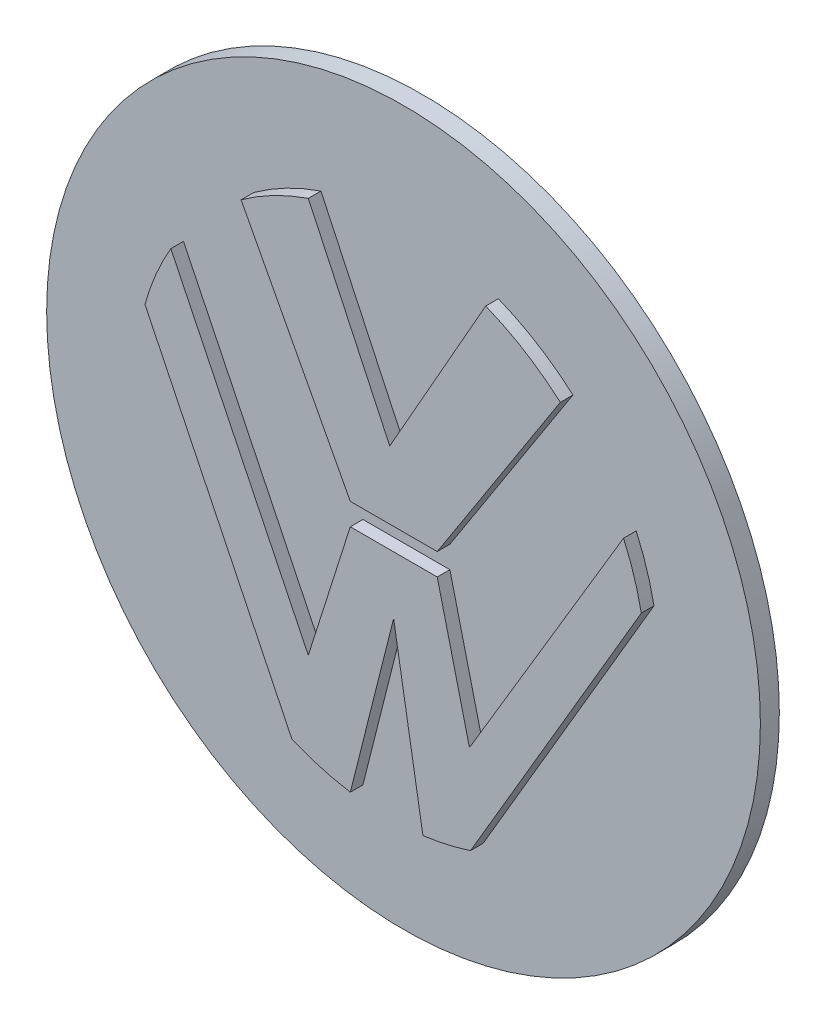
from build123d import *

# Parameters (mm, degrees)
SKETCH1_R            = 58.990480392
BOSS_EXTRUDE4_DEPTH  = 3.81
BOSS_EXTRUDE8_DEPTH  = 6.35
BOSS_EXTRUDE11_DEPTH = 6.35
BOSS_EXTRUDE12_DEPTH = 1.27
BOSS_EXTRUDE13_DEPTH = 3.81
SKETCH1_10_R         = 71.690480392
BOSS_EXTRUDE14_DEPTH = 3.81


with BuildPart() as part:
    # Sketch1 → Boss-Extrude4 (new body)
    with BuildSketch(Plane.XY):
        Circle(SKETCH1_R)
        with BuildLine():
            ThreePointArc((-44.203304283, 25.942359996), (-37.95196843, 34.446861163), (-30.091128704, 41.490506444))
            ThreePointArc((-30.091128704, 41.490506444), (-23.601953109, 45.495999397), (-16.590293497, 48.494332797))
            ThreePointArc((-16.590293497, 48.494332797), (1.313009125, 51.236843763), (19.052344379, 47.580944982))
            ThreePointArc((19.052344379, 47.580944982), (26.945123943, 43.599294116), (34.03630553, 38.320595736))
            ThreePointArc((34.03630553, 38.320595736), (41.302460875, 30.348721182), (46.739319117, 21.032693603))
            ThreePointArc((46.739319117, 21.032693603), (48.850499882, 15.510216406), (50.311661027, 9.781355549))
            ThreePointArc((50.311661027, 9.781355549), (51.017620288, 4.913305593), (51.253664764, 0))
            ThreePointArc((51.253664764, 0), (41.512829585, -30.060324875), (15.99284446, -48.694630893))
            ThreePointArc((15.99284446, -48.694630893), (11.267949041, -49.99971476), (6.439988792, -50.847464992))
            ThreePointArc((6.439988792, -50.847464992), (-0.864374418, -51.246375565), (-8.151129624, -50.601356084))
            ThreePointArc((-8.151129624, -50.601356084), (-14.115327494, -49.271651905), (-19.878887571, -47.24159164))
            ThreePointArc((-19.878887571, -47.24159164), (-46.117469302, -22.363299776), (-49.403992946, 13.644912337))
            ThreePointArc((-49.403992946, 13.644912337), (-47.205808206, 19.963712664), (-44.203304283, 25.942359996))
        make_face(mode=Mode.SUBTRACT)
    extrude(amount=BOSS_EXTRUDE4_DEPTH)

    # Sketch1<5> → Boss-Extrude8 (add)
    with BuildSketch(Plane.XY):
        with BuildLine():
            ThreePointArc((-16.590293497, 48.494332797), (-23.601953109, 45.495999397), (-30.091128704, 41.490506444))
            Line((-30.091128704, 41.490506444), (-8.151129624, 0))
            Line((-8.151129624, 0), (9.315576713, 0))
            Line((9.315576713, 0), (34.03630553, 38.320595736))
            ThreePointArc((34.03630553, 38.320595736), (26.945123943, 43.599294116), (19.052344379, 47.580944982))
            Line((19.052344379, 47.580944982), (-0.226270451, 13.588304137))
            Line((-0.226270451, 13.588304137), (-16.590293497, 48.494332797))
        make_face()
    extrude(amount=BOSS_EXTRUDE8_DEPTH)

    # Sketch1<7> → Boss-Extrude11 (add)
    with BuildSketch(Plane.XY):
        with BuildLine():
            Line((-16.590293497, -31.001033422), (-44.203304283, 25.942359996))
            ThreePointArc((-44.203304283, 25.942359996), (-47.205808206, 19.963712664), (-49.403992946, 13.644912337))
            Line((-49.403992946, 13.644912337), (-19.878887571, -47.24159164))
            ThreePointArc((-19.878887571, -47.24159164), (-14.115327494, -49.271651905), (-8.151129624, -50.601356084))
            Line((-8.151129624, -50.601356084), (0.554492374, -16.020255387))
            Line((0.554492374, -16.020255387), (6.439988792, -50.847464992))
            ThreePointArc((6.439988792, -50.847464992), (11.267949041, -49.99971476), (15.99284446, -48.694630893))
            Line((15.99284446, -48.694630893), (50.311661027, 9.781355549))
            ThreePointArc((50.311661027, 9.781355549), (48.850499882, 15.510216406), (46.739319117, 21.032693603))
            Line((46.739319117, 21.032693603), (15.784668638, -30.877460179))
            Line((15.784668638, -30.877460179), (9.315576713, -4.424898939))
            Line((9.315576713, -4.424898939), (-8.151129624, -4.424898939))
            Line((-8.151129624, -4.424898939), (-16.590293497, -31.001033422))
        make_face()
    extrude(amount=BOSS_EXTRUDE11_DEPTH)

    # Sketch1<8> → Boss-Extrude12 (add)
    with BuildSketch(Plane.XY):
        with BuildLine():
            ThreePointArc((-16.590293497, 48.494332797), (-23.601953109, 45.495999397), (-30.091128704, 41.490506444))
            Line((-30.091128704, 41.490506444), (-8.151129624, 0))
            Line((-8.151129624, 0), (9.315576713, 0))
            Line((9.315576713, 0), (34.03630553, 38.320595736))
            ThreePointArc((34.03630553, 38.320595736), (26.945123943, 43.599294116), (19.052344379, 47.580944982))
            Line((19.052344379, 47.580944982), (-0.226270451, 13.588304137))
            Line((-0.226270451, 13.588304137), (-16.590293497, 48.494332797))
        make_face()
    extrude(amount=BOSS_EXTRUDE12_DEPTH)

    # Sketch1<9> → Boss-Extrude13 (add)
    with BuildSketch(Plane.XY):
        with BuildLine():
            ThreePointArc((-16.590293497, 48.494332797), (-23.601953109, 45.495999397), (-30.091128704, 41.490506444))
            Line((-30.091128704, 41.490506444), (-8.151129624, 0))
            Line((-8.151129624, 0), (9.315576713, 0))
            Line((9.315576713, 0), (34.03630553, 38.320595736))
            ThreePointArc((34.03630553, 38.320595736), (26.945123943, 43.599294116), (19.052344379, 47.580944982))
            Line((19.052344379, 47.580944982), (-0.226270451, 13.588304137))
            Line((-0.226270451, 13.588304137), (-16.590293497, 48.494332797))
        make_face()
        with BuildLine():
            Line((-16.590293497, -31.001033422), (-44.203304283, 25.942359996))
            ThreePointArc((-44.203304283, 25.942359996), (-47.205808206, 19.963712664), (-49.403992946, 13.644912337))
            Line((-49.403992946, 13.644912337), (-19.878887571, -47.24159164))
            ThreePointArc((-19.878887571, -47.24159164), (-14.115327494, -49.271651905), (-8.151129624, -50.601356084))
            Line((-8.151129624, -50.601356084), (0.554492374, -16.020255387))
            Line((0.554492374, -16.020255387), (6.439988792, -50.847464992))
            ThreePointArc((6.439988792, -50.847464992), (11.267949041, -49.99971476), (15.99284446, -48.694630893))
            Line((15.99284446, -48.694630893), (50.311661027, 9.781355549))
            ThreePointArc((50.311661027, 9.781355549), (48.850499882, 15.510216406), (46.739319117, 21.032693603))
            Line((46.739319117, 21.032693603), (15.784668638, -30.877460179))
            Line((15.784668638, -30.877460179), (9.315576713, -4.424898939))
            Line((9.315576713, -4.424898939), (-8.151129624, -4.424898939))
            Line((-8.151129624, -4.424898939), (-16.590293497, -31.001033422))
        make_face()
    extrude(amount=BOSS_EXTRUDE13_DEPTH)

    # Sketch1<10> → Boss-Extrude14 (add)
    with BuildSketch(Plane.XY):
        Circle(SKETCH1_10_R)
    extrude(amount=BOSS_EXTRUDE14_DEPTH)


solid = part.part
